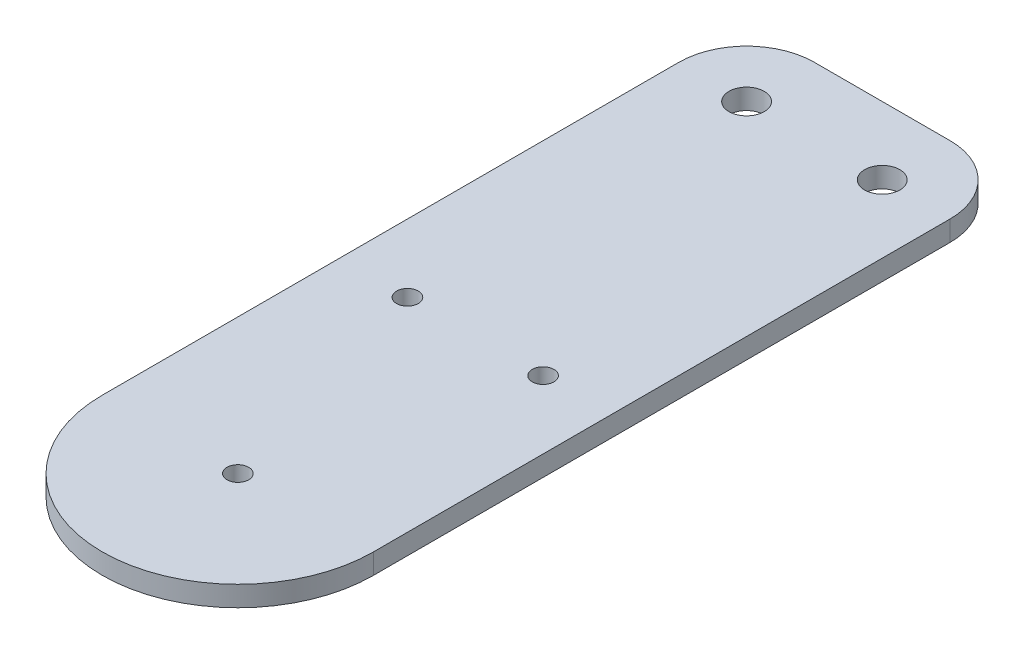
from build123d import *

# Parameters (mm, degrees)
SKETCH1_R           = 1.6
BOSS_EXTRUDE1_DEPTH = 3
SKETCH3_R           = 2.6
SKETCH3_R_2         = 1.6
CUT_EXTRUDE2_DEPTH  = 3
FILLET2_R           = 10


with BuildPart() as part:
    # Sketch1 → Boss-Extrude1 (new body)
    with BuildSketch(Plane(origin=(0, 0, 0), x_dir=(1, 0, 0), z_dir=(0, 1, 0))):
        with BuildLine():
            Line((0, 0), (0, 95))
            Line((0, 95), (40, 95))
            Line((40, 95), (40, 0))
            ThreePointArc((40, 0), (20, -20), (0, 0))
        make_face()
        with Locations(Location((20, 0, 0), (0, 0, 270))):
            Circle(SKETCH1_R, mode=Mode.SUBTRACT)
    extrude(amount=BOSS_EXTRUDE1_DEPTH)

    # Sketch3 → Cut-Extrude2 (cut)
    with BuildSketch(Plane(origin=(0, 3, 0), x_dir=(1, 0, 0), z_dir=(0, 1, 0))):
        with Locations(Location((10, 85, 0), (0, 0, 270))):
            Circle(SKETCH3_R)
        with Locations(Location((30, 85, 0), (0, 0, 270))):
            Circle(SKETCH3_R)
        with Locations(Location((10, 35, 0), (0, 0, 270))):
            Circle(SKETCH3_R_2)
        with Locations(Location((30, 35, 0), (0, 0, 270))):
            Circle(SKETCH3_R_2)
    extrude(amount=-CUT_EXTRUDE2_DEPTH, mode=Mode.SUBTRACT)

    # Fillet2
    fillet2_edges = [part.edges().sort_by_distance(p)[0] for p in [
        (0, 1.5, -95),
        (40, 1.5, -95),
    ]]
    fillet(fillet2_edges, radius=FILLET2_R)


solid = part.part
